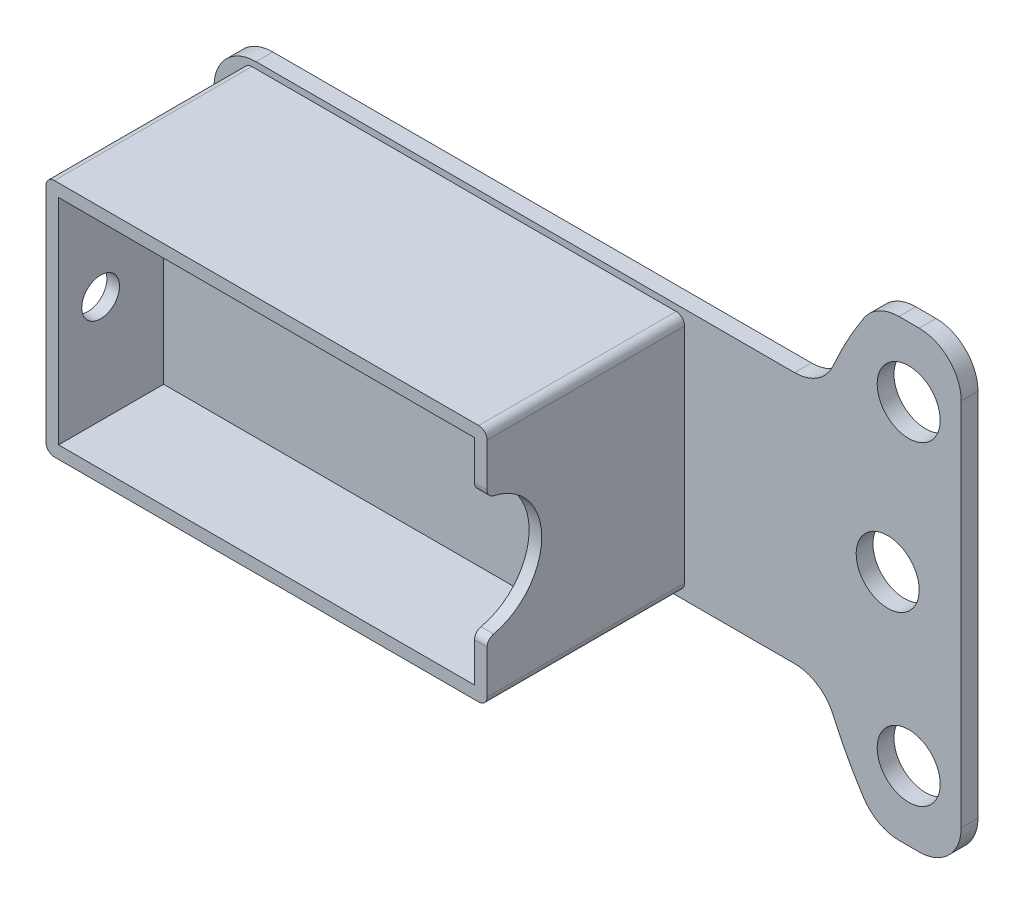
from build123d import *

# Parameters (mm, degrees)
RESSALTO_EXTRUS_O1_DEPTH = 4
ESBO_O2_R                = 7.5
CORTE_EXTRUS_O1_DEPTH    = 10
ESBO_O3_W                = 145
ESBO_O3_H                = 60
RESSALTO_EXTRUS_O3_DEPTH = 4
RESSALTO_EXTRUS_O4_DEPTH = 47
CORTE_EXTRUS_O3_DEPTH    = 10
ESBO_O6_R                = 4.5
CORTE_EXTRUS_O4_DEPTH    = 9
FILETE1_R                = 10
FILETE3_R                = 10
FILETE4_R                = 2
ESBO_O7_W                = 99
ESBO_O7_H                = 51
RESSALTO_EXTRUS_O5_DEPTH = 22


with BuildPart() as part:
    # Esboço1 → Ressalto-extrusão1 (new body)
    with BuildSketch(Plane.XY):
        with BuildLine():
            Line((-72, -54), (-52, -54))
            Line((-52, -54), (-52, 54))
            Line((-52, 54), (-72, 54))
            ThreePointArc((-72, 54), (-90, 0), (-72, -54))
        make_face()
    extrude(amount=RESSALTO_EXTRUS_O1_DEPTH)

    # Esboço2 → Corte-extrusão1 (cut)
    with BuildSketch(Plane(origin=(0, 0, 0), x_dir=(-1, 0, 0), z_dir=(0, 0, -1))):
        with Locations((69.5, 0)):
            Circle(ESBO_O2_R)
        with Locations((64.5, -37.5)):
            Circle(ESBO_O2_R)
        with Locations((64.5, 37.5)):
            Circle(ESBO_O2_R)
    extrude(amount=-CORTE_EXTRUS_O1_DEPTH, mode=Mode.SUBTRACT)

    # Esboço3 → Ressalto-extrusão3 (add)
    with BuildSketch(Plane.XY):
        with Locations((-157.352813742, 0)):
            Rectangle(ESBO_O3_W, ESBO_O3_H)
    extrude(amount=RESSALTO_EXTRUS_O3_DEPTH)

    # Esboço4 → Ressalto-extrusão4 (add)
    with BuildSketch(Plane.XY.offset(4)):
        Polygon((-219.852813742, 0), (-222.852813742, 0), (-222.852813742, -28.5), (-117.852813742, -28.5), (-117.852813742, 0), (-120.852813742, 0), (-120.852813742, -25.5), (-219.852813742, -25.5), align=None)
        Polygon((-222.852813742, 28.5), (-222.852813742, 0), (-219.852813742, 0), (-219.852813742, 25.5), (-120.852813742, 25.5), (-120.852813742, 0), (-117.852813742, 0), (-117.852813742, 28.5), align=None)
    extrude(amount=RESSALTO_EXTRUS_O4_DEPTH)

    # Esboço5 → Corte-extrusão3 (cut)
    with BuildSketch(Plane(origin=(-117.852813742, 0, 0), x_dir=(0, 0, -1), z_dir=(1, 0, 0))):
        with BuildLine():
            Line((-51, 14.5), (-51, -14.5))
            ThreePointArc((-51, -14.5), (-41.725847678, -9.737171047), (-38, 0))
            ThreePointArc((-38, 0), (-41.725847678, 9.737171047), (-51, 14.5))
        make_face()
    extrude(amount=-CORTE_EXTRUS_O3_DEPTH, mode=Mode.SUBTRACT)

    # Esboço6 → Corte-extrusão4 (cut)
    with BuildSketch(Plane.ZY.offset(222.852813742)):
        with Locations((41, 0)):
            Circle(ESBO_O6_R)
    extrude(amount=-CORTE_EXTRUS_O4_DEPTH, mode=Mode.SUBTRACT)

    # Filete1
    filete1_edges = [part.edges().sort_by_distance(p)[0] for p in [
        (-229.852813742, 30, 2),
        (-229.852813742, -30, 2),
    ]]
    fillet(filete1_edges, radius=FILETE1_R)

    # Filete3
    filete3_edges = [part.edges().sort_by_distance(p)[0] for p in [
        (-84.852813742, 30, 2),
        (-84.852813742, -30, 2),
        (-72, 54, 2),
        (-52, 54, 2),
        (-52, -54, 2),
        (-72, -54, 2),
    ]]
    fillet(filete3_edges, radius=FILETE3_R)

    # Filete4
    filete4_edges = [part.edges().sort_by_distance(p)[0] for p in [
        (-117.852813742, -28.5, 27.5),
        (-117.852813742, 28.5, 27.5),
        (-222.852813742, 28.5, 27.5),
        (-222.852813742, -28.5, 27.5),
        (-119.352813742, 14.5, 51),
        (-119.352813742, -14.5, 51),
    ]]
    fillet(filete4_edges, radius=FILETE4_R)

    # Esboço7 → Ressalto-extrusão5 (add)
    with BuildSketch(Plane.XY.offset(4)):
        with Locations((-170.352813742, 0)):
            Rectangle(ESBO_O7_W, ESBO_O7_H)
    extrude(amount=RESSALTO_EXTRUS_O5_DEPTH)


solid = part.part
